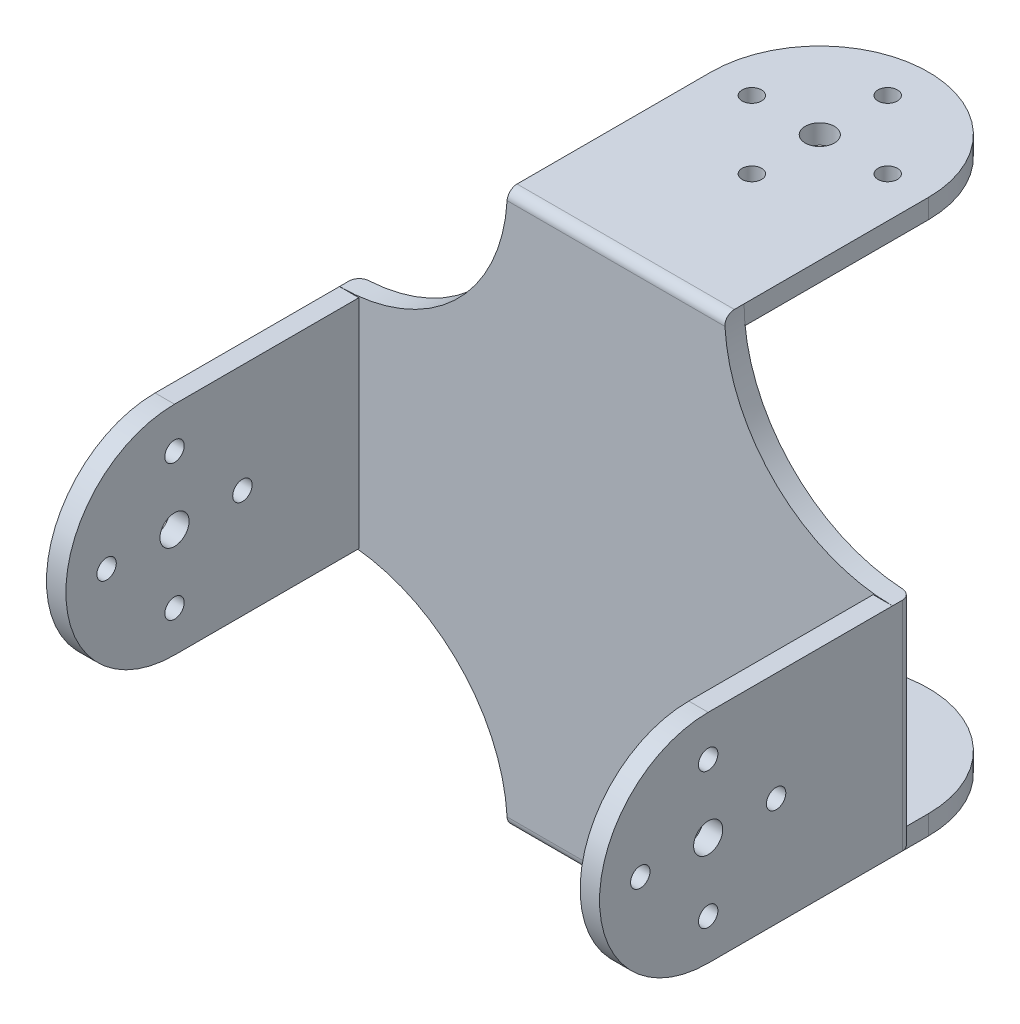
from build123d import *

# Parameters (mm, degrees)
EXTRUDE_3_DEPTH     = 2
EXTRUDE_8_DEPTH     = 2
EXTRUDE_9_DEPTH     = 2
SKETCH_14_R         = 1.5
SKETCH_14_R_2       = 1
CUT_EXTRUDE_4_DEPTH = 72.399299806
SKETCH_15_R         = 1.5
SKETCH_15_R_2       = 1
CUT_EXTRUDE_5_DEPTH = 72.399299806
FILLET_9_R          = 1
FILLET_10_R         = 1
FILLET_11_R         = 1
FILLET_12_R         = 1


with BuildPart() as part:
    # 草图1 → 凸台-拉伸3 (new body)
    with BuildSketch(Plane.XY):
        with BuildLine():
            Line((-11.196428571, 28.5), (11.196428571, 28.5))
            ThreePointArc((11.196428571, 28.5), (16.264527304, 16.264527304), (28.5, 11.196428571))
            Line((28.5, 11.196428571), (28.5, -11.196428571))
            ThreePointArc((28.5, -11.196428571), (16.264527304, -16.264527304), (11.196428571, -28.5))
            Line((11.196428571, -28.5), (-11.196428571, -28.5))
            ThreePointArc((-11.196428571, -28.5), (-16.264527304, -16.264527304), (-28.5, -11.196428571))
            Line((-28.5, -11.196428571), (-28.5, 11.196428571))
            ThreePointArc((-28.5, 11.196428571), (-16.264527304, 16.264527304), (-11.196428571, 28.5))
        make_face()
    extrude(amount=EXTRUDE_3_DEPTH)

    # 草图12 → 凸台-拉伸8 (add)
    with BuildSketch(Plane(origin=(0, 28.5, 0), x_dir=(1, 0, 0), z_dir=(0, 1, 0))):
        with BuildLine():
            Line((-11.196428571, -2), (-11.196428571, 19))
            ThreePointArc((-11.196428571, 19), (0, 30.196428571), (11.196428571, 19))
            Line((11.196428571, 19), (11.196428571, -2))
            Line((11.196428571, -2), (-11.196428571, -2))
        make_face()
    extrude_8 = extrude(amount=-EXTRUDE_8_DEPTH)

    # 镜向6: 凸台-拉伸8 across plane
    add(extrude_8.mirror(Plane.ZX))

    # 草图13 → 凸台-拉伸9 (add)
    with BuildSketch(Plane(origin=(28.5, 0, 0), x_dir=(0, 0, -1), z_dir=(1, 0, 0))):
        with BuildLine():
            Line((0, 11.196428571), (-21, 11.196428571))
            ThreePointArc((-21, 11.196428571), (-32.196428571, 0), (-21, -11.196428571))
            Line((-21, -11.196428571), (0, -11.196428571))
            Line((0, -11.196428571), (0, 11.196428571))
        make_face()
    extrude_9 = extrude(amount=-EXTRUDE_9_DEPTH)

    # 镜向7: 凸台-拉伸9 across plane
    add(extrude_9.mirror(Plane(origin=(0, 0, 0), x_dir=(0, 0, 1), z_dir=(1, 0, 0))))

    # 草图14 → 切除-拉伸4 (cut, through all)
    with BuildSketch(Plane.ZY.offset(28.5)):
        with Locations((21, 0)):
            Circle(SKETCH_14_R)
        with Locations((21, 7)):
            Circle(SKETCH_14_R_2)
        with Locations((28, 0)):
            Circle(SKETCH_14_R_2)
        with Locations((21, -7)):
            Circle(SKETCH_14_R_2)
        with Locations((14, 0)):
            Circle(SKETCH_14_R_2)
    extrude(amount=-CUT_EXTRUDE_4_DEPTH, mode=Mode.SUBTRACT)

    # 草图15 → 切除-拉伸5 (cut, through all)
    with BuildSketch(Plane.XZ.offset(28.5)):
        with Locations(Location((0, -19, 0), (0, 0, 270))):
            Circle(SKETCH_15_R)
        with Locations(Location((0, -12, 0), (0, 0, 270))):
            Circle(SKETCH_15_R_2)
        with Locations(Location((7, -19, 0), (0, 0, 270))):
            Circle(SKETCH_15_R_2)
        with Locations(Location((0, -26, 0), (0, 0, 270))):
            Circle(SKETCH_15_R_2)
        with Locations(Location((-7, -19, 0), (0, 0, 270))):
            Circle(SKETCH_15_R_2)
    extrude(amount=-CUT_EXTRUDE_5_DEPTH, mode=Mode.SUBTRACT)

    # 圆角9
    fillet_9_edges = [part.edges().sort_by_distance(p)[0] for p in [
        (-28.5, 0, 0),
    ]]
    fillet(fillet_9_edges, radius=FILLET_9_R)

    # 圆角10
    fillet_10_edges = [part.edges().sort_by_distance(p)[0] for p in [
        (28.5, 0, 0),
    ]]
    fillet(fillet_10_edges, radius=FILLET_10_R)

    # 圆角11
    fillet_11_edges = [part.edges().sort_by_distance(p)[0] for p in [
        (0, -28.5, 2),
    ]]
    fillet(fillet_11_edges, radius=FILLET_11_R)

    # 圆角12
    fillet_12_edges = [part.edges().sort_by_distance(p)[0] for p in [
        (0, 28.5, 2),
    ]]
    fillet(fillet_12_edges, radius=FILLET_12_R)


solid = part.part
